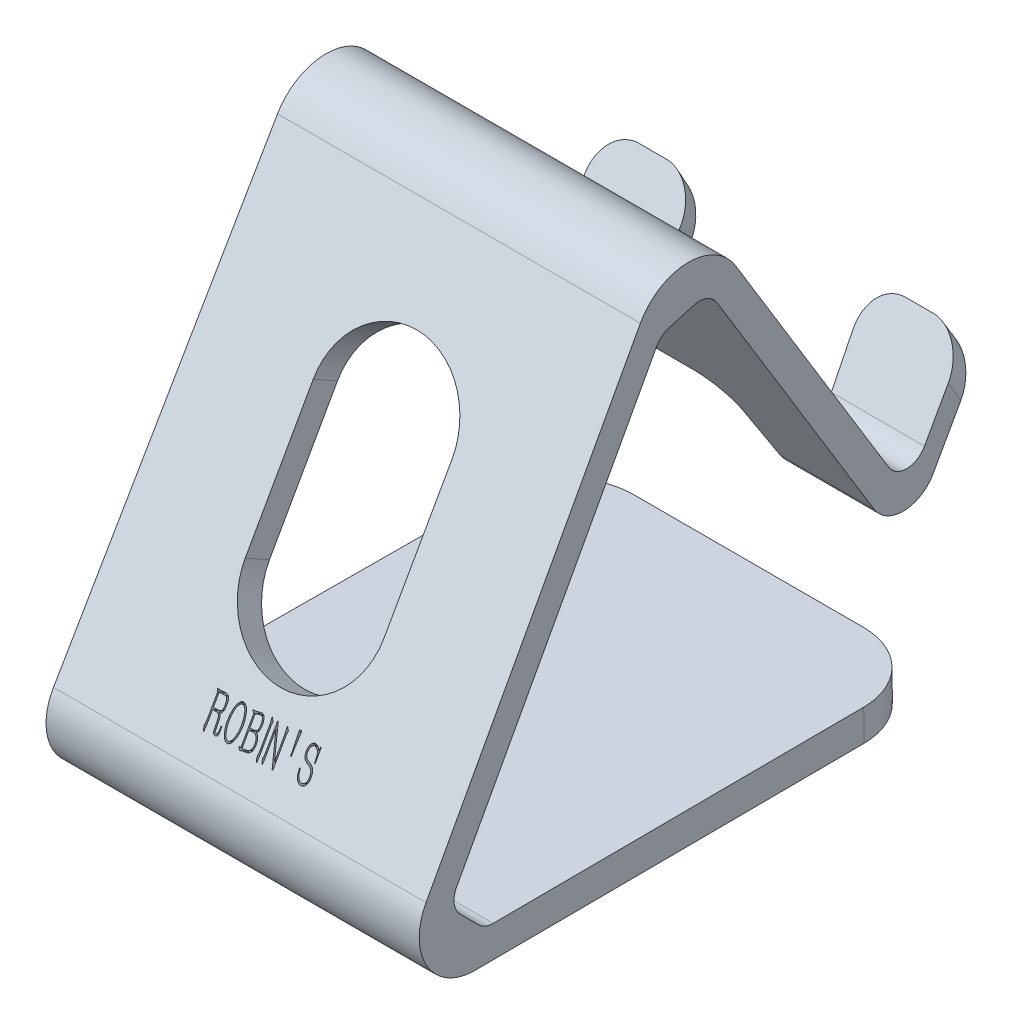
from build123d import *
from OCP.BRepFilletAPI import BRepFilletAPI_MakeChamfer

# Parameters (mm, degrees)
EXTRUDE_1_DEPTH                 = 27
CUT_EXTRUDE_1_DEPTH             = 122.415187402
CUT_EXTRUDE_2_REACH             = 86.433
CUT_EXTRUDE_2_DIRECTION_2_DEPTH = 85.432777042
FILLET_1_R                      = 10
CHAMFER_1_SIZE                  = 8
CHAMFER_1_SIZE2                 = 5.874394869
CHAMFER_1_SIZE2_2               = 5.87441912
FILLET_2_R                      = 8
FILLET_3_R                      = 3
FILLET_4_R                      = 5
FILLET_5_R                      = 5
SKETCH_8_R                      = 7
EXTRUDE_2_DEPTH                 = 1
CUT_EXTRUDE_3_REACH             = 118.382
CUT_EXTRUDE_4_DEPTH             = 1
FILLET_6_R                      = 5
SKETCH_12_R                     = 14.468983122
SKETCH_12_R_2                   = 13.256117975
CUT_EXTRUDE_7_DEPTH             = 1
CUT_EXTRUDE_8_DEPTH             = 1
FILLET_7_R                      = 3


with BuildPart() as part:
    # 草图1 → 凸台-拉伸1 (new, symmetric)
    with BuildSketch(Plane(origin=(0, 0, 0), x_dir=(0, 0, -1), z_dir=(1, 0, 0))):
        Polygon((0, 0), (80, 0), (80, 4.5), (7.120639938, 4.5), (45.133157634, 72.077809239), (76.133157634, 21.058971323), (87.250488433, 40.31475311), (85.433025117, 43.305877831), (76.596172431, 28), (45, 80), align=None)
    extrude(amount=EXTRUDE_1_DEPTH, both=True)

    # 草图4 → 切除-拉伸1 (cut, through all)
    with BuildSketch(Plane(origin=(0, 0, 0), x_dir=(1, 0, 0), z_dir=(0, 0.49026123963255896, 0.8715755371245493))):
        Polygon((-27, 0), (-26, 91.787798753), (-27, 91.787798753), align=None)
        Polygon((26, 91.787798753), (27, 91.787798753), (27, 0), align=None)
    extrude(amount=-CUT_EXTRUDE_1_DEPTH, mode=Mode.SUBTRACT)

    # 草图7 → 切除-拉伸2 (cut, up to next)
    with BuildSketch(Plane(origin=(0, 41.54167411, -68.367998004), x_dir=(-1, 0, 0), z_dir=(0, 0.5192752331681213, -0.8546070630518996)), mode=Mode.PRIVATE) as cut_extrude_2_sk1:
        Polygon((-11.5, 0), (11.5, 0), (14, -25), (-14, -25), align=None)
    cut_extrude_2_tool1 = extrude(cut_extrude_2_sk1.sketch, amount=-CUT_EXTRUDE_2_REACH, mode=Mode.PRIVATE) & part.part
    add(cut_extrude_2_tool1.solids().sort_by_distance((0, 30.509982, -75.071061))[0], mode=Mode.SUBTRACT)

    # 草图7 → 切除-拉伸2 direction 2 (cut)
    with BuildSketch(Plane(origin=(0, 41.54167411, -68.367998004), x_dir=(-1, 0, 0), z_dir=(0, 0.5192752331681213, -0.8546070630518996))):
        Polygon((-11.5, 0), (11.5, 0), (14, -25), (-14, -25), align=None)
    extrude(amount=CUT_EXTRUDE_2_DIRECTION_2_DEPTH, mode=Mode.SUBTRACT)

    # 圆角1
    fillet_1_edges = [part.edges().sort_by_distance(p)[0] for p in [
        (-26.551335312, 2.25, -80),
        (26.551335312, 2.25, -80),
    ]]
    fillet(fillet_1_edges, radius=FILLET_1_R)

    # 倒角1: one chamfer whose edges measure the first distance from different faces: ONE call of the kernel's chamfer builder (chamfer() names one face for all edges)
    chamfer_1_edges_1 = [part.edges().sort_by_distance(p)[0] for p in [
        (0, 72.077809239, -45.133157634),
    ]]
    chamfer_1_side_1 = [part.faces().sort_by_distance(p)[0] for p in [
        (0, 38.109372434, -26.025911932),
    ]]
    chamfer_1_edges_2 = [part.edges().sort_by_distance(p)[0] for p in [
        (0, 4.5, -7.120639938),
    ]]
    chamfer_1_side_2 = [part.faces().sort_by_distance(p)[0] for p in [
        (0, 4.5, -43.094391941),
    ]]
    chamfer_1 = BRepFilletAPI_MakeChamfer(part.part.solid().wrapped)
    for e in chamfer_1_edges_1:
        chamfer_1.Add(CHAMFER_1_SIZE, CHAMFER_1_SIZE2, e.wrapped, chamfer_1_side_1[0].wrapped)  # the first distance lies on this face
    for e in chamfer_1_edges_2:
        chamfer_1.Add(CHAMFER_1_SIZE, CHAMFER_1_SIZE2_2, e.wrapped, chamfer_1_side_2[0].wrapped)  # the first distance lies on this face
    add(Compound.cast(chamfer_1.Shape()), mode=Mode.REPLACE)

    # 圆角2
    fillet_2_edges = [part.edges().sort_by_distance(p)[0] for p in [
        (0, 0, 0),
        (0, 80, -45),
    ]]
    fillet(fillet_2_edges, radius=FILLET_2_R)

    # 圆角3
    fillet_3_edges = [part.edges().sort_by_distance(p)[0] for p in [
        (19.70477768, 28, -76.596172431),
        (-19.70477768, 28, -76.596172431),
    ]]
    fillet(fillet_3_edges, radius=FILLET_3_R)

    # 圆角4
    fillet_4_edges = [part.edges().sort_by_distance(p)[0] for p in [
        (-26.141815514, 41.810315471, -86.341756775),
        (26.141815514, 41.810315471, -86.341756775),
        (-12.410374497, 41.810315471, -86.341756775),
        (12.410374497, 41.810315471, -86.341756775),
    ]]
    fillet(fillet_4_edges, radius=FILLET_4_R)

    # 圆角5
    fillet_5_edges = [part.edges().sort_by_distance(p)[0] for p in [
        (20.023539658, 21.058971323, -76.133157634),
        (-20.023539658, 21.058971323, -76.133157634),
    ]]
    fillet(fillet_5_edges, radius=FILLET_5_R)

    # 草图8 → 凸台-拉伸2 (add)
    with BuildSketch(Plane.XZ):
        with Locations(Location((-16.625519305, -70, 0), (0, 0, 90))):
            Circle(SKETCH_8_R)
        with Locations(Location((16.625519305, -70, 0), (0, 0, 90))):
            Circle(SKETCH_8_R)
        with Locations(Location((0, -25, 0), (0, 0, 90))):
            Circle(SKETCH_8_R)
    extrude(amount=EXTRUDE_2_DEPTH)

    # 草图9 → 切除-拉伸3 (cut, up to next)
    with BuildSketch(Plane(origin=(0, 0, 0), x_dir=(1, 0, 0), z_dir=(0, 0.49026123963255896, 0.8715755371245493)), mode=Mode.PRIVATE) as cut_extrude_3_sk1:
        with BuildLine():
            Line((-10, 35.678779875), (-10, 55.678779875))
            ThreePointArc((-10, 55.678779875), (0, 65.678779875), (10, 55.678779875))
            Line((10, 55.678779875), (10, 35.678779875))
            ThreePointArc((10, 35.678779875), (0, 25.678779875), (-10, 35.678779875))
        make_face()
    cut_extrude_3_tool1 = extrude(cut_extrude_3_sk1.sketch, amount=-CUT_EXTRUDE_3_REACH, mode=Mode.PRIVATE) & part.part
    add(cut_extrude_3_tool1.solids().sort_by_distance((0, 39.812507, -22.394535))[0], mode=Mode.SUBTRACT)

    # 草图11 → 切除-拉伸4 (cut)
    # profile 1 of 7: a face of its own
    with BuildSketch(Plane(origin=(0, 0, 0), x_dir=(1, 0, 0), z_dir=(0, 0.49026123963255896, 0.8715755371245493))):
        with BuildLine():
            add(Edge.make_bspline(
                [(-6.031871762, 20.114633863), (-6.010537227, 20.083758577), (-5.971845225, 20.027763607), (-5.916642006, 19.947027309), (-5.872950531, 19.860818106), (-5.845418093, 19.755333719), (-5.823792472, 19.627997883), (-5.807931117, 19.479922318), (-5.795369729, 19.316135297), (-5.794651528, 19.202309376), (-5.794283865, 19.14403936)],
                knots=[0, 0, 0, 0, 0.881232765, 1.598190978, 2.295533752, 3.137383339, 4.144986829, 5.328248715, 6.632271209, 8, 8, 8, 8], degree=3))
            Line((-5.794283865, 19.14403936), (-5.772975533, 18.474957749))
            add(Edge.make_bspline(
                [(-5.772975533, 18.474957749), (-5.772278621, 18.437702367), (-5.770930834, 18.365652654), (-5.768830268, 18.264066379), (-5.757508267, 18.18036003), (-5.743648254, 18.119503027), (-5.712399467, 18.088081891), (-5.676597232, 18.073727664), (-5.628388459, 18.066521139), (-5.591883792, 18.065396762), (-5.5716118, 18.064772367)],
                knots=[0, 0, 0, 0, 1.650852431, 3.192651296, 4.477622576, 5.427192863, 5.849578153, 6.384274066, 7.102745334, 8, 8, 8, 8], degree=3))
            add(Edge.make_bspline(
                [(-5.5716118, 18.064772367), (-5.551267524, 18.063800581), (-5.513205481, 18.061982469), (-5.45777072, 18.080135669), (-5.412589655, 18.120973015), (-5.381351604, 18.183633875), (-5.357778078, 18.261194957), (-5.344605389, 18.355071783), (-5.331649485, 18.465569962), (-5.324236647, 18.545959337), (-5.320173488, 18.59002274)],
                knots=[0, 0, 0, 0, 0.741895998, 1.388010978, 2.079699508, 2.912679041, 3.92113713, 5.042206699, 6.378760387, 8, 8, 8, 8], degree=3))
            Line((-5.320173488, 18.59002274), (-5.283949324, 19.000208122))
            Line((-5.283949324, 19.000208122), (-5.190192665, 19.000208122))
            Line((-5.190192665, 19.000208122), (-5.190192665, 18.496266081))
            add(Edge.make_bspline(
                [(-5.190192665, 18.496266081), (-5.190603599, 18.448669403), (-5.191361368, 18.360900429), (-5.196581699, 18.240800056), (-5.204058756, 18.143179252), (-5.216702115, 18.066112727), (-5.23400506, 18.003426085), (-5.258587312, 17.951554529), (-5.288569958, 17.905989533), (-5.326369414, 17.87052418), (-5.367040053, 17.840991234), (-5.411592808, 17.819749915), (-5.458469054, 17.804359376), (-5.521607216, 17.795951174), (-5.59331755, 17.793974146), (-5.648331656, 17.797049111), (-5.672826375, 17.798418222)],
                knots=[0, 0, 0, 0, 1.955595562, 3.606146949, 4.93917426, 5.975540879, 6.81139212, 7.601269519, 8.32576276, 9.0378047, 9.718034635, 10.383709129, 11.057491241, 11.736467872, 12.992175141, 14, 14, 14, 14], degree=3))
            add(Edge.make_bspline(
                [(-5.672826375, 17.798418222), (-5.690001811, 17.79986472), (-5.722787711, 17.802625916), (-5.768147962, 17.817431721), (-5.808501618, 17.836358413), (-5.843615393, 17.862510812), (-5.873066011, 17.896819962), (-5.897361131, 17.939391411), (-5.918506828, 17.989903133), (-5.93687243, 18.050147366), (-5.952104568, 18.123506811), (-5.961307314, 18.213085618), (-5.97034802, 18.319968917), (-5.972942089, 18.397158775), (-5.974339266, 18.438733586)],
                knots=[0, 0, 0, 0, 0.785514098, 1.499454538, 2.167605402, 2.81714562, 3.484704239, 4.219933844, 5.049370252, 5.984178009, 7.095655963, 8.469322192, 10.098360771, 12, 12, 12, 12], degree=3))
            Line((-5.974339266, 18.438733586), (-5.981797182, 18.783928557))
            Line((-5.981797182, 18.783928557), (-5.989255099, 19.136581444))
            add(Edge.make_bspline(
                [(-5.989255099, 19.136581444), (-5.991891855, 19.182764894), (-5.997494267, 19.28089255), (-6.010186399, 19.429373872), (-6.023964622, 19.573287756), (-6.049092074, 19.69977443), (-6.086251021, 19.806622926), (-6.135316087, 19.897635117), (-6.195844731, 19.972957307), (-6.271686157, 20.025098442), (-6.360310373, 20.054209998), (-6.461305739, 20.070121018), (-6.576629827, 20.076063255), (-6.657989311, 20.072718219), (-6.700953373, 20.070951783)],
                knots=[0, 0, 0, 0, 1.186982176, 2.522024164, 3.82431485, 4.894934829, 5.823070192, 6.716229133, 7.537699214, 8.278355097, 9.042196562, 9.911176558, 10.896940655, 12, 12, 12, 12], degree=3))
            Line((-6.700953373, 20.070951783), (-7.05360626, 20.042185535))
            Line((-7.05360626, 20.042185535), (-7.05360626, 18.344976927))
            add(Edge.make_bspline(
                [(-7.05360626, 18.344976927), (-7.056728811, 18.289214885), (-7.06241774, 18.187622845), (-7.071063976, 18.050932221), (-7.077698545, 17.944736311), (-7.082766759, 17.847766737), (-7.089428028, 17.754893428), (-7.099314951, 17.676795428), (-7.110205942, 17.626003946), (-7.115466454, 17.604684457), (-7.122523222, 17.587632153), (-7.129783868, 17.589848887), (-7.132447087, 17.59066199)],
                knots=[0, 0, 0, 0, 2.178702561, 3.969346042, 5.343442504, 6.32866056, 7.759955515, 8.962971945, 9.43033784, 9.732921223, 9.902035012, 10, 10, 10, 10], degree=3))
            add(Edge.make_bspline(
                [(-7.132447087, 17.59066199), (-7.135674331, 17.591628094), (-7.143627526, 17.594008953), (-7.159359365, 17.602931104), (-7.17644025, 17.630267191), (-7.195295087, 17.670397122), (-7.213349641, 17.71699733), (-7.217117732, 17.749301605), (-7.218745829, 17.763259475)],
                knots=[0, 0, 0, 0, 0.301236197, 0.742364128, 1.580669581, 3.100179862, 4.747060191, 6, 6, 6, 6], degree=3))
            Line((-7.218745829, 17.763259475), (-7.305044572, 18.022155704))
            add(Edge.make_bspline(
                [(-7.305044572, 18.022155704), (-7.313162875, 18.04559767), (-7.327415368, 18.086752387), (-7.34634664, 18.139670095), (-7.356388872, 18.175770699), (-7.361453718, 18.204859612), (-7.349152986, 18.23426363), (-7.331461922, 18.273611252), (-7.311236585, 18.327481207), (-7.293878373, 18.392165811), (-7.278714649, 18.45788117), (-7.268826129, 18.513410845), (-7.265183716, 18.565162292), (-7.260375678, 18.623325695), (-7.257965611, 18.702246646), (-7.255124802, 18.793875158), (-7.25165217, 18.882997915), (-7.25061108, 18.954426869), (-7.247273875, 19.000185827), (-7.247456235, 19.022225375), (-7.247512077, 19.02897437)],
                knots=[0, 0, 0, 0, 1.301962309, 2.285725083, 2.940890519, 3.278257869, 3.802826989, 4.553745501, 5.567560366, 6.806006901, 8.066807115, 9.104973239, 9.759343731, 10.786589445, 12.166193442, 13.899498157, 15.595566675, 16.84419832, 17.646068083, 18, 18, 18, 18], degree=3))
            Line((-7.247512077, 19.02897437), (-7.247512077, 21.840608719))
            add(Edge.make_bspline(
                [(-7.247512077, 21.840608719), (-7.248002868, 21.862332542), (-7.24894152, 21.903879968), (-7.259405936, 21.962939656), (-7.272580566, 22.016964077), (-7.289481036, 22.048267416), (-7.297586656, 22.063280784)],
                knots=[0, 0, 0, 0, 1.127954724, 2.157245254, 3.116197974, 4, 4, 4, 4], degree=3))
            Line((-7.297586656, 22.063280784), (-7.370034983, 22.170887858))
            add(Edge.make_bspline(
                [(-7.370034983, 22.170887858), (-7.377315278, 22.183891136), (-7.390414249, 22.207287108), (-7.405621473, 22.240342189), (-7.410565128, 22.266920777), (-7.412303972, 22.289439483), (-7.395949446, 22.305758734), (-7.368341803, 22.309278818), (-7.330057949, 22.309250654), (-7.300756679, 22.303948551), (-7.283736241, 22.30086868)],
                knots=[0, 0, 0, 0, 1.380566717, 2.483966017, 3.320820912, 3.912566683, 4.446905125, 5.258929739, 6.407774973, 8, 8, 8, 8], degree=3))
            Line((-7.283736241, 22.30086868), (-7.132447087, 22.285952848))
            Line((-7.132447087, 22.285952848), (-6.981157933, 22.264644517))
            Line((-6.981157933, 22.264644517), (-6.700953373, 22.285952848))
            add(Edge.make_bspline(
                [(-6.700953373, 22.285952848), (-6.645561351, 22.289680281), (-6.544037127, 22.296512036), (-6.405112659, 22.303426196), (-6.293952188, 22.30981764), (-6.205998681, 22.315241511), (-6.131873671, 22.315840309), (-6.063061963, 22.303221886), (-5.995613642, 22.282033227), (-5.930625001, 22.250763314), (-5.869427272, 22.211798404), (-5.813589577, 22.165646622), (-5.763829343, 22.112924328), (-5.720698218, 22.051912463), (-5.682422218, 21.981497982), (-5.652469921, 21.897877965), (-5.625513374, 21.802270875), (-5.606579045, 21.693623797), (-5.590646395, 21.574558181), (-5.578913932, 21.445895873), (-5.572806156, 21.307961904), (-5.572018639, 21.213084064), (-5.5716118, 21.164069192)],
                knots=[0, 0, 0, 0, 1.680330416, 3.079761997, 4.210278293, 5.049824392, 5.748610684, 6.446652486, 7.157163236, 7.883197757, 8.622714282, 9.348032282, 10.070477093, 10.810227951, 11.603784503, 12.488235885, 13.492302087, 14.607589106, 15.822258459, 17.128285687, 18.516442711, 20, 20, 20, 20], degree=3))
            add(Edge.make_bspline(
                [(-5.5716118, 21.164069192), (-5.572002154, 21.117185481), (-5.572733013, 21.029405252), (-5.578429354, 20.907387326), (-5.589798144, 20.804149948), (-5.610466108, 20.694660676), (-5.645472471, 20.577064217), (-5.694654992, 20.451684288), (-5.74924694, 20.342764804), (-5.799896214, 20.265999501), (-5.841468639, 20.217339992), (-5.86877479, 20.188451597), (-5.896560071, 20.168856087), (-5.915601033, 20.160879761), (-5.924264687, 20.157250526)],
                knots=[0, 0, 0, 0, 1.521433389, 2.848575118, 3.962184411, 4.888901171, 6.460870269, 7.93539991, 9.254863418, 10.408771879, 10.907539274, 11.331296887, 11.695739513, 12, 12, 12, 12], degree=3))
            Line((-5.924264687, 20.157250526), (-6.031871762, 20.114633863))
        make_face()
        with BuildLine():
            Line((-7.059998759, 20.30853968), (-6.348300485, 20.337305927))
            add(Edge.make_bspline(
                [(-6.348300485, 20.337305927), (-6.319844138, 20.338966057), (-6.265903054, 20.342112954), (-6.189942556, 20.353795324), (-6.123296542, 20.370316305), (-6.049370952, 20.399657559), (-5.972091697, 20.446994602), (-5.910547617, 20.509539238), (-5.873037983, 20.568362794), (-5.850638536, 20.621387656), (-5.828504859, 20.681105307), (-5.812004752, 20.751665005), (-5.796245577, 20.835386992), (-5.786837587, 20.937339963), (-5.7791551, 21.058479168), (-5.776902596, 21.193879317), (-5.776495352, 21.331492574), (-5.78536097, 21.459867059), (-5.798971835, 21.573353774), (-5.815371244, 21.642903261), (-5.823050112, 21.675469149)],
                knots=[0, 0, 0, 0, 0.918061632, 1.740252825, 2.473002692, 3.125389995, 4.297175273, 5.365424526, 5.921000699, 6.535663214, 7.216150394, 7.97108314, 8.866688876, 9.959840128, 11.266871048, 12.777820325, 14.322752802, 15.699036693, 16.922595727, 18, 18, 18, 18], degree=3))
            add(Edge.make_bspline(
                [(-5.823050112, 21.675469149), (-5.831409533, 21.705622534), (-5.847086033, 21.762169462), (-5.882165339, 21.837052784), (-5.919078576, 21.899817618), (-5.966234371, 21.946268226), (-6.019388006, 21.9812458), (-6.080073971, 22.008296964), (-6.150019251, 22.02594392), (-6.199760282, 22.031571173), (-6.225777579, 22.034514536)],
                knots=[0, 0, 0, 0, 1.275305387, 2.391592206, 3.369358846, 4.230813774, 5.067494819, 5.95694154, 6.931367957, 8, 8, 8, 8], degree=3))
            add(Edge.make_bspline(
                [(-6.225777579, 22.034514536), (-6.234301723, 22.034569667), (-6.255261985, 22.034705231), (-6.292183001, 22.03318143), (-6.340839814, 22.03225867), (-6.400873833, 22.031496947), (-6.472235447, 22.028873466), (-6.5550061, 22.027203807), (-6.649094158, 22.023573335), (-6.715867308, 22.021667613), (-6.751027952, 22.02066412)],
                knots=[0, 0, 0, 0, 0.389305479, 0.957274318, 1.687402304, 2.612145096, 3.699440328, 4.948883328, 6.393377747, 8, 8, 8, 8], degree=3))
            Line((-6.751027952, 22.02066412), (-7.05360626, 22.005748288))
            Line((-7.05360626, 22.005748288), (-7.059998759, 20.30853968))
        make_face(mode=Mode.SUBTRACT)
    # profile 2 of 7: a face of its own
    with BuildSketch(Plane(origin=(0, 0, 0), x_dir=(1, 0, 0), z_dir=(0, 0.49026123963255896, 0.8715755371245493))):
        with BuildLine():
            add(Edge.make_bspline(
                [(-4.800250198, 20.150858026), (-4.795870003, 20.219805993), (-4.786844294, 20.361878307), (-4.761303821, 20.579949712), (-4.728298226, 20.809521333), (-4.687069834, 21.045518215), (-4.635494338, 21.279352423), (-4.56508265, 21.498428625), (-4.481139421, 21.70023358), (-4.381964285, 21.879313041), (-4.278022846, 22.033853365), (-4.177622077, 22.16012686), (-4.083115864, 22.257213852), (-3.990000149, 22.322506839), (-3.901335696, 22.362821742), (-3.819995542, 22.390823937), (-3.743817191, 22.409080632), (-3.694435116, 22.408670939), (-3.670908625, 22.408475755)],
                knots=[0, 0, 0, 0, 1.217793816, 2.509352989, 3.869389901, 5.306369188, 6.732518591, 8.086865491, 9.357865112, 10.57959578, 11.689225504, 12.637700741, 13.421327601, 14.069152645, 14.629329011, 15.132240194, 15.586583926, 16, 16, 16, 16], degree=3))
            add(Edge.make_bspline(
                [(-3.670908625, 22.408475755), (-3.648349328, 22.404561252), (-3.600382141, 22.396237956), (-3.527439201, 22.367592875), (-3.448618942, 22.328327542), (-3.365890014, 22.275147798), (-3.282763352, 22.207436991), (-3.204154927, 22.122073803), (-3.133155093, 22.018493499), (-3.045724289, 21.857423252), (-2.950592753, 21.636150541), (-2.875548174, 21.400970444), (-2.826879838, 21.202689894), (-2.793305824, 21.044353759), (-2.766236796, 20.877136394), (-2.735328659, 20.644193648), (-2.707536045, 20.348204656), (-2.711962025, 20.110433621), (-2.714164538, 19.992110956)],
                knots=[0, 0, 0, 0, 0.394985608, 0.839846589, 1.347857167, 1.916750551, 2.536277094, 3.196746505, 3.915575437, 4.701623328, 6.36253532, 8.071356979, 8.963406565, 9.891884595, 10.869033514, 11.891140732, 13.955296867, 16, 16, 16, 16], degree=3))
            add(Edge.make_bspline(
                [(-2.714164538, 19.992110956), (-2.716010288, 19.947703652), (-2.719839054, 19.855586521), (-2.731456004, 19.713371714), (-2.750638265, 19.562593932), (-2.779347484, 19.349183104), (-2.83312964, 19.076110489), (-2.90747314, 18.805586843), (-2.980538197, 18.593955566), (-3.04327583, 18.443166593), (-3.112631844, 18.300061227), (-3.189323004, 18.168079797), (-3.269005838, 18.049298893), (-3.35436616, 17.950832341), (-3.440642807, 17.871725095), (-3.530547544, 17.815932933), (-3.617360781, 17.777970033), (-3.697872615, 17.751562131), (-3.77313087, 17.738611133), (-3.820743764, 17.740150027), (-3.843506111, 17.740885727)],
                knots=[0, 0, 0, 0, 0.881282943, 1.828105941, 2.82824081, 3.894865892, 6.097710261, 8.340987808, 9.452332789, 10.535200188, 11.577677107, 12.603151353, 13.560288859, 14.408919748, 15.182050945, 15.871786862, 16.496001568, 17.057257397, 17.549302039, 18, 18, 18, 18], degree=3))
            add(Edge.make_bspline(
                [(-3.843506111, 17.740885727), (-3.867096935, 17.743688735), (-3.916618986, 17.749572831), (-3.992201229, 17.774669369), (-4.072062033, 17.812511512), (-4.156446021, 17.863370913), (-4.241875196, 17.931791029), (-4.321172085, 18.023440405), (-4.398328503, 18.133904695), (-4.469091229, 18.264651239), (-4.535280141, 18.410037735), (-4.594463956, 18.566931249), (-4.647849488, 18.732603087), (-4.694226294, 18.905037456), (-4.731388887, 19.080249384), (-4.763181859, 19.25202102), (-4.783898725, 19.418930396), (-4.79840589, 19.579555515), (-4.803540761, 19.733540535), (-4.807370708, 19.879860423), (-4.806596588, 20.018103109), (-4.802320993, 20.107540762), (-4.800250198, 20.150858026)],
                knots=[0, 0, 0, 0, 0.510534934, 1.071719088, 1.704710998, 2.411693894, 3.189282936, 4.05053371, 5.011670478, 6.086573801, 7.246791516, 8.449877322, 9.695482973, 10.994127406, 12.29322218, 13.551907867, 14.754774865, 15.913908135, 17.0238299, 18.071869134, 19.066149983, 20, 20, 20, 20], degree=3))
        make_face()
        with BuildLine():
            add(Edge.make_bspline(
                [(-4.591428548, 20.135942194), (-4.593444941, 20.100437649), (-4.5976971, 20.025565839), (-4.599339602, 19.907234461), (-4.598382972, 19.777211135), (-4.591536737, 19.586442004), (-4.566719139, 19.334614809), (-4.522983942, 19.079893191), (-4.473754711, 18.877121195), (-4.431283205, 18.731778024), (-4.384592642, 18.594147466), (-4.332083519, 18.467069387), (-4.276295954, 18.352480678), (-4.214725824, 18.256050377), (-4.153161086, 18.174904437), (-4.084661567, 18.115673563), (-4.018381092, 18.069808466), (-3.954285916, 18.038673412), (-3.894758972, 18.014787619), (-3.855056858, 18.00968359), (-3.836048195, 18.007239872)],
                knots=[0, 0, 0, 0, 0.796536737, 1.679732718, 2.650327695, 3.709147218, 5.954918549, 8.313069364, 9.492003862, 10.627402775, 11.704181224, 12.745734999, 13.706334556, 14.553839847, 15.30675304, 15.97732542, 16.573080319, 17.10674674, 17.572326302, 18, 18, 18, 18], degree=3))
            add(Edge.make_bspline(
                [(-3.836048195, 18.007239872), (-3.816476636, 18.006087977), (-3.775964922, 18.003703637), (-3.71372939, 18.015924773), (-3.64860419, 18.037425397), (-3.58116157, 18.072109802), (-3.511270593, 18.121660721), (-3.444422702, 18.193222684), (-3.377735446, 18.283369198), (-3.312311636, 18.390757107), (-3.249392681, 18.509853132), (-3.193496813, 18.637447689), (-3.141529639, 18.769216117), (-3.084513385, 18.953937195), (-3.021644732, 19.191546326), (-2.97222917, 19.481763276), (-2.937817703, 19.764858127), (-2.919481972, 19.994678758), (-2.916754851, 20.177508812), (-2.920358677, 20.324959059), (-2.928471558, 20.485262703), (-2.93889408, 20.596234513), (-2.944294519, 20.653734651)],
                knots=[0, 0, 0, 0, 0.389303871, 0.805830913, 1.253424913, 1.753499798, 2.311288848, 2.951911425, 3.695005091, 4.54345845, 5.455166886, 6.377091015, 7.318103512, 8.276048787, 10.227707478, 12.21152619, 14.136557685, 15.91040834, 16.802233067, 17.779101204, 18.849239395, 20, 20, 20, 20], degree=3))
            add(Edge.make_bspline(
                [(-2.944294519, 20.653734651), (-2.950238154, 20.706002334), (-2.961790099, 20.807588887), (-2.985900031, 20.95376786), (-3.010634022, 21.090182957), (-3.051052989, 21.257323364), (-3.109513589, 21.45943456), (-3.184680469, 21.653035118), (-3.253202973, 21.798654067), (-3.308439187, 21.893270283), (-3.371336734, 21.970133309), (-3.43703157, 22.031048218), (-3.503737736, 22.076541467), (-3.566430238, 22.111595526), (-3.626893187, 22.134275403), (-3.666851903, 22.139595573), (-3.685824457, 22.14212161)],
                knots=[0, 0, 0, 0, 1.251575308, 2.432539829, 3.524812851, 4.549720602, 6.523204923, 8.527303315, 9.483611249, 10.351763581, 11.126540771, 11.838283349, 12.475927762, 13.043152764, 13.545685196, 14, 14, 14, 14], degree=3))
            add(Edge.make_bspline(
                [(-3.685824457, 22.14212161), (-3.704337653, 22.140776619), (-3.743569699, 22.137926395), (-3.804722082, 22.124222669), (-3.868270833, 22.096673845), (-3.939370684, 22.063433047), (-4.014366377, 22.00741512), (-4.090321832, 21.922918964), (-4.170251537, 21.81080372), (-4.255675778, 21.674625965), (-4.337488439, 21.514863664), (-4.404371789, 21.332645783), (-4.462825495, 21.133622202), (-4.503025386, 20.920454718), (-4.536482829, 20.707115518), (-4.561406345, 20.503387345), (-4.582084418, 20.314910554), (-4.588404011, 20.19387122), (-4.591428548, 20.135942194)],
                knots=[0, 0, 0, 0, 0.37757334, 0.800130614, 1.267198275, 1.784369715, 2.394414205, 3.156344445, 4.08734282, 5.194407036, 6.425938495, 7.73207238, 9.1388751, 10.642807986, 12.142427514, 13.533772035, 14.819671431, 16, 16, 16, 16], degree=3))
        make_face(mode=Mode.SUBTRACT)
    # profile 3 of 7: a face of its own
    with BuildSketch(Plane(origin=(0, 0, 0), x_dir=(1, 0, 0), z_dir=(0, 0.49026123963255896, 0.8715755371245493))):
        with BuildLine():
            add(Edge.make_bspline(
                [(-2.007793347, 21.90559913), (-2.025190842, 21.919082393), (-2.056742444, 21.943535253), (-2.104031883, 21.980313239), (-2.148400052, 22.028634126), (-2.190116405, 22.073560567), (-2.223028451, 22.114693822), (-2.239692277, 22.142219781), (-2.25097203, 22.163586582), (-2.249225442, 22.185538302), (-2.237204332, 22.202325561), (-2.225557358, 22.224313367), (-2.193544179, 22.230210175), (-2.158180278, 22.216911121), (-2.120565776, 22.205731297), (-2.090958167, 22.195997437), (-2.064951811, 22.195195837), (-2.034061145, 22.195063265), (-1.989695879, 22.198141353), (-1.935659054, 22.19921482), (-1.880851554, 22.202950887), (-1.833468952, 22.209123032), (-1.797241481, 22.212417497), (-1.777955399, 22.21927302), (-1.77020545, 22.222027854)],
                knots=[0, 0, 0, 0, 1.64763205, 2.988098512, 4.472525849, 6.542356651, 7.584071831, 8.395257026, 8.967619365, 9.340564694, 9.97047718, 10.50190227, 11.107820098, 12.171334353, 13.314207223, 14.055349962, 14.481319576, 15.251885957, 16.369143228, 17.804974755, 19.296756072, 20.473415709, 21.386554954, 22, 22, 22, 22], degree=3))
            Line((-1.77020545, 22.222027854), (-1.410094647, 22.314719096))
            add(Edge.make_bspline(
                [(-1.410094647, 22.314719096), (-1.399114935, 22.317687263), (-1.374817508, 22.324255634), (-1.333652362, 22.332081402), (-1.285179091, 22.343219842), (-1.230719017, 22.353948419), (-1.176706502, 22.36613978), (-1.127426532, 22.372634235), (-1.086739579, 22.379383249), (-1.062079329, 22.379608677), (-1.05104926, 22.379709507)],
                knots=[0, 0, 0, 0, 0.746644526, 1.652278328, 2.750112717, 4.012480095, 5.297690843, 6.382818677, 7.276664985, 8, 8, 8, 8], degree=3))
            add(Edge.make_bspline(
                [(-1.05104926, 22.379709507), (-1.027509285, 22.377149001), (-0.980474474, 22.372032899), (-0.911390544, 22.352842059), (-0.845793273, 22.32083973), (-0.78308225, 22.279699367), (-0.725898242, 22.228217673), (-0.67374883, 22.168918715), (-0.629036067, 22.100374033), (-0.591825034, 22.022314981), (-0.560196996, 21.935888134), (-0.533191028, 21.839771841), (-0.512829821, 21.733803994), (-0.496308458, 21.621055556), (-0.483932547, 21.508004001), (-0.475578618, 21.400320674), (-0.469862624, 21.301212005), (-0.468782072, 21.237944751), (-0.468266392, 21.207751272)],
                knots=[0, 0, 0, 0, 0.788100513, 1.574689806, 2.373814472, 3.210589555, 4.065404581, 4.929098289, 5.834801075, 6.781980012, 7.803943584, 8.897694274, 10.10426717, 11.396006919, 12.693423483, 13.892139677, 14.994050896, 16, 16, 16, 16], degree=3))
            add(Edge.make_bspline(
                [(-0.468266392, 21.207751272), (-0.471340263, 21.159410952), (-0.477548326, 21.061781705), (-0.49587342, 20.914098165), (-0.523370504, 20.762572074), (-0.556115677, 20.637165911), (-0.586127478, 20.543147713), (-0.608828629, 20.487044411), (-0.629091544, 20.444014425), (-0.647904673, 20.424369834), (-0.65577971, 20.416146754)],
                knots=[0, 0, 0, 0, 1.41233288, 2.852380741, 4.337314802, 5.89979107, 6.630150315, 7.21096505, 7.669715816, 8, 8, 8, 8], degree=3))
            Line((-0.65577971, 20.416146754), (-0.806003447, 20.265923017))
            add(Edge.make_bspline(
                [(-0.806003447, 20.265923017), (-0.77359714, 20.243791594), (-0.714964362, 20.203749179), (-0.648588187, 20.147602361), (-0.601091563, 20.099727032), (-0.566093556, 20.052294093), (-0.526062199, 19.994386886), (-0.469416124, 19.900172483), (-0.401807361, 19.765901441), (-0.35881218, 19.614550887), (-0.332664302, 19.481428541), (-0.322415622, 19.367251473), (-0.315413211, 19.241437105), (-0.316440861, 19.153640304), (-0.316977238, 19.107815197)],
                knots=[0, 0, 0, 0, 1.070182896, 1.936283469, 2.368030692, 2.906882123, 3.541225939, 4.289096852, 5.905680189, 7.625612947, 8.562596306, 9.604952081, 10.749916543, 12, 12, 12, 12], degree=3))
            add(Edge.make_bspline(
                [(-0.316977238, 19.107815197), (-0.318723585, 19.064468503), (-0.322121595, 18.980125278), (-0.333490916, 18.856961884), (-0.352303069, 18.740903703), (-0.373515394, 18.631282062), (-0.402586552, 18.529441353), (-0.437147745, 18.435754801), (-0.47905092, 18.350258062), (-0.528362353, 18.273342999), (-0.583897561, 18.203519048), (-0.64678125, 18.141035194), (-0.715969051, 18.084572415), (-0.792083003, 18.034454738), (-0.873530011, 17.990695317), (-0.9613065, 17.955637186), (-1.053790208, 17.926347002), (-1.118373925, 17.913579673), (-1.151198418, 17.907090713)],
                knots=[0, 0, 0, 0, 1.291181941, 2.512358873, 3.678492505, 4.789671877, 5.833657235, 6.827132701, 7.758433233, 8.661592748, 9.541502867, 10.408556622, 11.295108621, 12.19516981, 13.117306623, 14.041863747, 15.004782726, 16, 16, 16, 16], degree=3))
            Line((-1.151198418, 17.907090713), (-1.568841717, 17.849558218))
            add(Edge.make_bspline(
                [(-1.568841717, 17.849558218), (-1.591176395, 17.845720731), (-1.633271238, 17.838488104), (-1.692584873, 17.832650687), (-1.743031583, 17.823426839), (-1.796952189, 17.819774986), (-1.854044778, 17.809273047), (-1.905554926, 17.779772533), (-1.93268265, 17.74773995), (-1.951190585, 17.737512069), (-1.956653351, 17.734493228)],
                knots=[0, 0, 0, 0, 1.312917143, 2.474494646, 3.452532002, 4.279929402, 5.608244096, 6.780169529, 7.639957153, 8, 8, 8, 8], degree=3))
            add(Edge.make_bspline(
                [(-1.956653351, 17.734493228), (-1.962147908, 17.733883968), (-1.976075412, 17.732339628), (-1.991753298, 17.747284823), (-2.008858784, 17.763524001), (-2.031497454, 17.780784806), (-2.059749679, 17.804830929), (-2.10729791, 17.83948107), (-2.162632352, 17.887486497), (-2.214932781, 17.947693562), (-2.248348188, 17.999910083), (-2.267042078, 18.041741762), (-2.270558156, 18.067663615), (-2.272318248, 18.089087302), (-2.245624059, 18.096184101), (-2.227999345, 18.099004356), (-2.21554958, 18.10099653)],
                knots=[0, 0, 0, 0, 0.408406666, 1.035221836, 1.516918604, 2.252554637, 3.200824533, 4.366195779, 6.758465887, 8.80503204, 10.444321207, 11.5313617, 12.220697094, 12.548554928, 12.974726626, 14, 14, 14, 14], degree=3))
            Line((-2.21554958, 18.10099653), (-2.007793347, 18.10099653))
            Line((-2.007793347, 18.10099653), (-2.007793347, 21.90559913))
        make_face()
        with BuildLine():
            Line((-1.820280029, 20.323455512), (-1.252412993, 20.387380507))
            add(Edge.make_bspline(
                [(-1.252412993, 20.387380507), (-1.2232819, 20.391203167), (-1.168505212, 20.398391111), (-1.092393564, 20.4096359), (-1.028195363, 20.421835674), (-0.973042207, 20.432245671), (-0.924132422, 20.451940007), (-0.881222226, 20.485472653), (-0.841204023, 20.530410974), (-0.792762527, 20.606666293), (-0.739826876, 20.713003243), (-0.695344334, 20.851404822), (-0.666473135, 20.997327976), (-0.660979735, 21.150199275), (-0.662465555, 21.304689578), (-0.662269317, 21.408044754), (-0.662172209, 21.459189584)],
                knots=[0, 0, 0, 0, 0.873777503, 1.643008589, 2.287243073, 2.817622504, 3.309938555, 3.837999608, 4.421262104, 5.092045153, 6.518435707, 7.941185456, 9.403523715, 10.926684676, 12.47918417, 14, 14, 14, 14], degree=3))
            add(Edge.make_bspline(
                [(-0.662172209, 21.459189584), (-0.66455647, 21.491204795), (-0.669101466, 21.552233782), (-0.682737427, 21.638777412), (-0.696664061, 21.716237773), (-0.720448984, 21.804735555), (-0.759794391, 21.902758897), (-0.819812135, 21.984524901), (-0.874429475, 22.036436507), (-0.916321512, 22.067730351), (-0.961611042, 22.087925596), (-1.021099576, 22.102337232), (-1.090681876, 22.108825567), (-1.157646189, 22.105437558), (-1.210531723, 22.095718275), (-1.257897662, 22.087538819), (-1.313419068, 22.075320033), (-1.353610237, 22.067454356), (-1.3749359, 22.063280784)],
                knots=[0, 0, 0, 0, 1.337822755, 2.550224273, 3.650783, 4.616944903, 6.368664393, 8.021145033, 8.796181901, 9.507039394, 10.189576941, 10.84675067, 12.051897664, 13.090030714, 13.630410622, 14.292569305, 15.094027531, 16, 16, 16, 16], degree=3))
            Line((-1.3749359, 22.063280784), (-1.820280029, 21.948215793))
            Line((-1.820280029, 21.948215793), (-1.820280029, 20.323455512))
        make_face(mode=Mode.SUBTRACT)
        with BuildLine():
            add(Edge.make_bspline(
                [(-1.820280029, 18.10099653), (-1.789395086, 18.098705817), (-1.732634779, 18.094495947), (-1.655520731, 18.090984964), (-1.594052091, 18.091065697), (-1.543804877, 18.09259225), (-1.495051094, 18.099945532), (-1.438335653, 18.104948058), (-1.369372371, 18.116088903), (-1.263462756, 18.127933329), (-1.13236795, 18.153460148), (-1.006321955, 18.186035532), (-0.91574124, 18.2265722), (-0.852696509, 18.26887463), (-0.792190335, 18.322806324), (-0.719885214, 18.410449813), (-0.639814749, 18.525327257), (-0.574761199, 18.672664772), (-0.531834976, 18.817899149), (-0.513278788, 18.962728701), (-0.506842468, 19.104586972), (-0.510259892, 19.198021618), (-0.511948472, 19.244188518)],
                knots=[0, 0, 0, 0, 0.898162711, 1.650642252, 2.237699247, 2.68104558, 3.106443072, 3.666024881, 4.33166218, 5.131363942, 6.755447525, 8.202702255, 8.893980373, 9.622392647, 10.39559097, 11.23565845, 12.912443945, 14.438192962, 15.885447693, 17.289548788, 18.660741617, 20, 20, 20, 20], degree=3))
            add(Edge.make_bspline(
                [(-0.511948472, 19.244188518), (-0.517685117, 19.303986843), (-0.528718601, 19.418998973), (-0.560905853, 19.583187394), (-0.610331139, 19.732095621), (-0.686446402, 19.860065591), (-0.779532209, 19.967420643), (-0.887279642, 20.048189979), (-0.997735393, 20.102113616), (-1.092012073, 20.128571015), (-1.173475676, 20.134861685), (-1.250683341, 20.13566908), (-1.346271389, 20.130668222), (-1.415792973, 20.125122005), (-1.453776726, 20.122091779)],
                knots=[0, 0, 0, 0, 1.438130322, 2.76600445, 4.000792246, 5.175154235, 6.308219456, 7.383388526, 8.376306419, 9.238740087, 9.708503365, 10.329505009, 11.087309779, 12, 12, 12, 12], degree=3))
            Line((-1.453776726, 20.122091779), (-1.820280029, 20.078409699))
            Line((-1.820280029, 20.078409699), (-1.820280029, 18.10099653))
        make_face(mode=Mode.SUBTRACT)
    # profile 4 of 7: a face of its own
    with BuildSketch(Plane(origin=(0, 0, 0), x_dir=(1, 0, 0), z_dir=(0, 0.49026123963255896, 0.8715755371245493))):
        with BuildLine():
            Line((0.30309521, 22.473466166), (0.360627706, 22.538456577))
            Line((0.360627706, 22.538456577), (0.677056429, 22.113355363))
            add(Edge.make_bspline(
                [(0.677056429, 22.113355363), (0.670592991, 22.089120863), (0.658657534, 22.044369167), (0.636855377, 21.979912804), (0.618475647, 21.911864622), (0.605174545, 21.845999376), (0.597106772, 21.777906831), (0.593288199, 21.708191502), (0.591552291, 21.62185288), (0.591037945, 21.558629332), (0.590757686, 21.524179995)],
                knots=[0, 0, 0, 0, 1.004175213, 1.854321033, 2.723758726, 3.82552311, 4.541751514, 5.467964897, 6.620341098, 8, 8, 8, 8], degree=3))
            Line((0.590757686, 21.524179995), (0.590757686, 18.373743174))
            Line((0.590757686, 18.373743174), (0.569449355, 17.777109891))
            add(Edge.make_bspline(
                [(0.569449355, 17.777109891), (0.568937063, 17.743952055), (0.568000434, 17.683329332), (0.556236907, 17.613859518), (0.544064767, 17.569467228), (0.536732842, 17.550932263), (0.528615647, 17.536670344), (0.522012515, 17.538708011), (0.519374776, 17.539521994)],
                knots=[0, 0, 0, 0, 2.350389122, 4.297234295, 5.032515409, 5.553050425, 5.821457962, 6, 6, 6, 6], degree=3))
            add(Edge.make_bspline(
                [(0.519374776, 17.539521994), (0.51616027, 17.540497733), (0.508238466, 17.542902338), (0.492354214, 17.551354958), (0.47977617, 17.580439845), (0.472734207, 17.604228558), (0.46823478, 17.619428237)],
                knots=[0, 0, 0, 0, 0.403031229, 0.993227006, 2.078837504, 4, 4, 4, 4], degree=3))
            Line((0.46823478, 17.619428237), (0.433076033, 17.712119479))
            Line((0.433076033, 17.712119479), (0.35316979, 17.971015708))
            add(Edge.make_bspline(
                [(0.35316979, 17.971015708), (0.345115374, 17.995896811), (0.331080596, 18.039252006), (0.311653484, 18.094886865), (0.302006094, 18.132491524), (0.296857407, 18.161782306), (0.3082158, 18.190989137), (0.322931237, 18.230957529), (0.341371188, 18.285105107), (0.35826038, 18.350203672), (0.372468605, 18.418510876), (0.382161781, 18.484026981), (0.388639686, 18.544829798), (0.392524763, 18.599571765), (0.395526926, 18.660662777), (0.395665424, 18.739541972), (0.397307051, 18.851398816), (0.397016071, 18.936991806), (0.396851869, 18.98529229)],
                knots=[0, 0, 0, 0, 1.214579163, 2.116397919, 2.728090024, 3.026630229, 3.470478885, 4.138035078, 5.024200554, 6.115768324, 7.260198826, 8.260311231, 9.188705593, 10.09772701, 10.807310684, 12.027247325, 13.758158969, 16, 16, 16, 16], degree=3))
            Line((0.396851869, 18.98529229), (0.396851869, 21.624329153))
            add(Edge.make_bspline(
                [(0.396851869, 21.624329153), (0.39669578, 21.67761639), (0.396396899, 21.779651209), (0.387206711, 21.92603288), (0.374942554, 22.058608025), (0.358713885, 22.174933093), (0.343752661, 22.270653648), (0.335386108, 22.327144757), (0.331861458, 22.35094326)],
                knots=[0, 0, 0, 0, 1.312774966, 2.513711841, 3.612622797, 4.592819118, 5.407184629, 6, 6, 6, 6], degree=3))
            Line((0.331861458, 22.35094326), (0.30309521, 22.473466166))
        make_face()
    # profile 5 of 7: a face of its own
    with BuildSketch(Plane(origin=(0, 0, 0), x_dir=(1, 0, 0), z_dir=(0, 0.49026123963255896, 0.8715755371245493))):
        with BuildLine():
            Line((2.509572943, 22.429784086), (2.574563355, 22.494774498))
            Line((2.574563355, 22.494774498), (2.883534162, 22.113355363))
            add(Edge.make_bspline(
                [(2.883534162, 22.113355363), (2.876801878, 22.090149783), (2.86377669, 22.045253132), (2.842123338, 21.990404766), (2.829268385, 21.942845222), (2.820782235, 21.899425287), (2.813639108, 21.847476491), (2.805750565, 21.771862512), (2.800382539, 21.684770827), (2.798182518, 21.617940545), (2.797235419, 21.589170406)],
                knots=[0, 0, 0, 0, 1.084494799, 2.098210167, 2.643672211, 3.294173657, 4.083496456, 4.997481927, 6.707429351, 8, 8, 8, 8], degree=3))
            Line((2.797235419, 21.589170406), (2.797235419, 17.698269064))
            Line((2.797235419, 17.698269064), (2.689628345, 17.698269064))
            Line((2.689628345, 17.698269064), (1.337614708, 21.552946243))
            Line((1.337614708, 21.552946243), (1.337614708, 18.281051932))
            add(Edge.make_bspline(
                [(1.337614708, 18.281051932), (1.337281754, 18.254062388), (1.336571967, 18.196526429), (1.334952929, 18.104478544), (1.328821404, 18.001942502), (1.322940028, 17.894829255), (1.317146784, 17.797982675), (1.307759656, 17.721481355), (1.30230734, 17.677644179), (1.287838756, 17.645435279), (1.258220221, 17.657805073), (1.234901568, 17.683650224), (1.20904648, 17.733367709), (1.194814844, 17.774113197), (1.186325554, 17.798418222)],
                knots=[0, 0, 0, 0, 1.182286761, 2.52038347, 4.031227312, 5.682702803, 7.210982332, 8.306924227, 8.990285397, 9.270708198, 9.606495757, 10.101576878, 10.867574663, 12, 12, 12, 12], degree=3))
            Line((1.186325554, 17.798418222), (1.071260563, 18.122304862))
            add(Edge.make_bspline(
                [(1.071260563, 18.122304862), (1.063735866, 18.142961779), (1.051076462, 18.177714571), (1.042530121, 18.230263242), (1.055812387, 18.281204536), (1.069492677, 18.33027729), (1.083006366, 18.382455091), (1.09470653, 18.434603883), (1.106263777, 18.497536842), (1.117618653, 18.571108599), (1.130488775, 18.655030922), (1.136459281, 18.749430109), (1.142820384, 18.853452544), (1.142704316, 18.925970688), (1.142643474, 18.963983959)],
                knots=[0, 0, 0, 0, 0.927779361, 1.560877733, 2.200839638, 3.115853294, 3.718492711, 4.470182357, 5.368516448, 6.414355644, 7.608241643, 8.944514625, 10.398345751, 12, 12, 12, 12], degree=3))
            Line((1.142643474, 18.963983959), (1.142643474, 22.444699918))
            Line((1.142643474, 22.444699918), (1.251315965, 22.444699918))
            Line((1.251315965, 22.444699918), (2.603329602, 18.575106908))
            Line((2.603329602, 18.575106908), (2.603329602, 21.58171249))
            add(Edge.make_bspline(
                [(2.603329602, 21.58171249), (2.602690011, 21.640677886), (2.601429429, 21.756893819), (2.593795981, 21.899274699), (2.586658613, 22.005420582), (2.581428324, 22.073262481), (2.576279346, 22.129764763), (2.569112418, 22.189522647), (2.55934898, 22.2555592), (2.545256107, 22.305247457), (2.538339191, 22.329634928)],
                knots=[0, 0, 0, 0, 1.880234277, 3.705786779, 4.545737466, 5.272737238, 5.875620033, 6.354622927, 7.192433219, 8, 8, 8, 8], degree=3))
            Line((2.538339191, 22.329634928), (2.509572943, 22.429784086))
        make_face()
    # profile 6 of 7: a face of its own
    with BuildSketch(Plane(origin=(0, 0, 0), x_dir=(1, 0, 0), z_dir=(0, 0.49026123963255896, 0.8715755371245493))):
        with BuildLine():
            Line((4.273902796, 19.992110956), (4.252594465, 20.128484278))
            Line((4.252594465, 20.128484278), (4.245136549, 20.452370918))
            Line((4.245136549, 20.452370918), (4.209977802, 21.128910445))
            Line((4.209977802, 21.128910445), (4.187604053, 21.617936654))
            Line((4.187604053, 21.617936654), (4.166295722, 22.092047031))
            Line((4.166295722, 22.092047031), (4.152445306, 22.516082829))
            add(Edge.make_bspline(
                [(4.152445306, 22.516082829), (4.151028333, 22.535253838), (4.148406166, 22.570730562), (4.149771436, 22.61976921), (4.148160572, 22.660726313), (4.151114688, 22.685141104), (4.152445306, 22.696138231)],
                knots=[0, 0, 0, 0, 1.278352038, 2.365641966, 3.263837993, 4, 4, 4, 4], degree=3))
            add(Edge.make_bspline(
                [(4.152445306, 22.696138231), (4.155093254, 22.717753827), (4.159915555, 22.757118987), (4.183775068, 22.8070642), (4.215590543, 22.840522643), (4.251955187, 22.860241964), (4.291608876, 22.8663504), (4.317968852, 22.86299299), (4.331435291, 22.8612778)],
                knots=[0, 0, 0, 0, 1.388123159, 2.527975238, 3.477480882, 4.302056574, 5.132576923, 6, 6, 6, 6], degree=3))
            add(Edge.make_bspline(
                [(4.331435291, 22.8612778), (4.345278852, 22.855929597), (4.372453611, 22.845431132), (4.401527552, 22.810971934), (4.423723902, 22.770978884), (4.438126561, 22.731682667), (4.446261837, 22.693516199), (4.451873517, 22.656201557), (4.452992608, 22.610549267), (4.453620668, 22.577516975), (4.453958198, 22.559764909)],
                knots=[0, 0, 0, 0, 1.009092479, 1.980837482, 3.024215728, 4.172429535, 4.850747326, 5.717823987, 6.773523204, 8, 8, 8, 8], degree=3))
            add(Edge.make_bspline(
                [(4.453958198, 22.559764909), (4.452905431, 22.549110087), (4.45037947, 22.523545383), (4.445507451, 22.478182108), (4.443474366, 22.419096425), (4.436510782, 22.319429381), (4.432994212, 22.177601652), (4.42788032, 22.060074387), (4.42519195, 21.998290372)],
                knots=[0, 0, 0, 0, 0.342743849, 0.822364341, 1.459890564, 2.234257353, 4.020351281, 6, 6, 6, 6], degree=3))
            Line((4.42519195, 21.998290372), (4.411341535, 21.545488327))
            Line((4.411341535, 21.545488327), (4.382575287, 20.891322548))
            Line((4.382575287, 20.891322548), (4.375117371, 20.30853968))
            Line((4.375117371, 20.30853968), (4.360201539, 20.042185535))
            add(Edge.make_bspline(
                [(4.360201539, 20.042185535), (4.359787782, 20.020061695), (4.359096073, 19.983075649), (4.343855797, 19.937642717), (4.32260706, 19.914580353), (4.299957096, 19.905755274), (4.282680037, 19.917447898), (4.271546573, 19.935768123), (4.269776056, 19.962475152), (4.272430131, 19.981535143), (4.273902796, 19.992110956)],
                knots=[0, 0, 0, 0, 2.083211322, 3.482657118, 4.382574336, 5.008246272, 5.548279692, 6.180195123, 6.990245252, 8, 8, 8, 8], degree=3))
        make_face()
    # profile 7 of 7: a face of its own
    with BuildSketch(Plane(origin=(0, 0, 0), x_dir=(1, 0, 0), z_dir=(0, 0.49026123963255896, 0.8715755371245493))):
        with BuildLine():
            Line((7.354022123, 21.919449546), (7.42647045, 22.358401176))
            Line((7.42647045, 22.358401176), (7.497853361, 22.35094326))
            Line((7.497853361, 22.35094326), (7.497853361, 20.553585493))
            Line((7.497853361, 20.553585493), (7.411554618, 20.546127577))
            Line((7.411554618, 20.546127577), (7.361480039, 21.30790043))
            add(Edge.make_bspline(
                [(7.361480039, 21.30790043), (7.354887012, 21.350260706), (7.342699595, 21.428565005), (7.318809669, 21.534606619), (7.296651715, 21.621384184), (7.262316881, 21.70932548), (7.211365888, 21.803214245), (7.136315313, 21.903848232), (7.04626809, 21.994498902), (6.93948264, 22.065807992), (6.823742557, 22.120308425), (6.740530254, 22.130666243), (6.699856344, 22.135729111)],
                knots=[0, 0, 0, 0, 1.116474761, 2.063838624, 2.831507158, 3.446633667, 4.518832044, 5.603216916, 6.708904972, 7.82779241, 8.938231816, 10, 10, 10, 10], degree=3))
            add(Edge.make_bspline(
                [(6.699856344, 22.135729111), (6.675623094, 22.134690382), (6.625869393, 22.13255775), (6.563414892, 22.117869221), (6.510188571, 22.098388599), (6.466170179, 22.073326195), (6.417753674, 22.039759751), (6.367176241, 21.998090131), (6.316319922, 21.950475944), (6.271215172, 21.895141041), (6.231619209, 21.834546928), (6.189159728, 21.747203932), (6.146879443, 21.635880018), (6.118929247, 21.520578049), (6.106712179, 21.424192126), (6.099207863, 21.342815659), (6.094388954, 21.251481115), (6.090161209, 21.152722727), (6.09379462, 21.050977504), (6.108455271, 20.951479832), (6.134850086, 20.856814493), (6.161422528, 20.797986232), (6.174605971, 20.768799641)],
                knots=[0, 0, 0, 0, 0.864038106, 1.773971445, 2.275285977, 2.88209936, 3.574564674, 4.376127188, 5.218616224, 6.055847121, 6.916999662, 7.795414815, 9.515900782, 11.157236165, 12.013901558, 12.981067707, 14.072720019, 15.277182195, 16.507433409, 17.699229733, 18.858513907, 20, 20, 20, 20], degree=3))
            add(Edge.make_bspline(
                [(6.174605971, 20.768799641), (6.189532348, 20.741734457), (6.218641065, 20.688953209), (6.273081238, 20.618682858), (6.337016017, 20.561730455), (6.426819713, 20.503705702), (6.5345412, 20.451846791), (6.619450507, 20.417557087), (6.657239681, 20.402296339)],
                knots=[0, 0, 0, 0, 0.892298636, 1.740118821, 2.553971753, 3.353728668, 4.822268012, 6, 6, 6, 6], degree=3))
            Line((6.657239681, 20.402296339), (6.908677993, 20.301081764))
            add(Edge.make_bspline(
                [(6.908677993, 20.301081764), (6.939699151, 20.286775345), (6.999428414, 20.259229245), (7.083611305, 20.215407281), (7.159827496, 20.17207317), (7.247521508, 20.1133796), (7.344149841, 20.03629228), (7.439629287, 19.929977891), (7.517215365, 19.809493553), (7.565882171, 19.66901052), (7.604212734, 19.516609939), (7.630093928, 19.351048487), (7.647181575, 19.170297542), (7.65404978, 18.97691673), (7.651008018, 18.777081427), (7.625463124, 18.646628564), (7.612918351, 18.582564824)],
                knots=[0, 0, 0, 0, 0.703245545, 1.354054533, 1.953549274, 2.507188807, 3.525842386, 4.488918984, 5.43838142, 6.454223102, 7.53246407, 8.673253088, 9.899948524, 11.268249991, 12.658472344, 14, 14, 14, 14], degree=3))
            add(Edge.make_bspline(
                [(7.612918351, 18.582564824), (7.597233471, 18.518317127), (7.566852808, 18.393873237), (7.501123459, 18.250896606), (7.443507458, 18.149792632), (7.400824202, 18.084270054), (7.358143625, 18.027962272), (7.30236311, 17.961881451), (7.216333871, 17.892223004), (7.115963822, 17.836753467), (7.023573607, 17.802266953), (6.9468864, 17.782550794), (6.864548583, 17.772557316), (6.80784098, 17.770638245), (6.778697171, 17.769651975)],
                knots=[0, 0, 0, 0, 1.868422262, 3.619020558, 4.429541533, 5.162879566, 5.830420081, 6.429075538, 7.606854402, 8.938752151, 9.657684361, 10.394048182, 11.174651193, 12, 12, 12, 12], degree=3))
            add(Edge.make_bspline(
                [(6.778697171, 17.769651975), (6.745970096, 17.769860167), (6.681913099, 17.770267662), (6.588193434, 17.785426012), (6.499753383, 17.813169694), (6.417396251, 17.854420939), (6.340371226, 17.905943827), (6.26883498, 17.967061609), (6.202675004, 18.037129339), (6.140200605, 18.114791621), (6.085478022, 18.202486056), (6.036030688, 18.297862202), (5.993736879, 18.401410568), (5.946318974, 18.54755201), (5.904651353, 18.733203417), (5.892733254, 18.883508508), (5.886943495, 18.956526042)],
                knots=[0, 0, 0, 0, 0.833862414, 1.63212638, 2.411403016, 3.189256699, 3.973153178, 4.770028097, 5.583768076, 6.428386665, 7.307987397, 8.215552436, 9.166047206, 10.157242313, 12.13320567, 14, 14, 14, 14], degree=3))
            Line((5.886943495, 18.956526042), (5.858177248, 19.337945177))
            Line((5.858177248, 19.337945177), (5.959391822, 19.337945177))
            add(Edge.make_bspline(
                [(5.959391822, 19.337945177), (5.965213999, 19.292812043), (5.976415043, 19.20598228), (5.996096125, 19.080729094), (6.015066205, 18.965269875), (6.039315367, 18.827285655), (6.077250746, 18.671417284), (6.137013979, 18.502026005), (6.215055677, 18.353371426), (6.298434348, 18.248946029), (6.370137302, 18.17629579), (6.427299924, 18.134585807), (6.482983454, 18.098554246), (6.558450713, 18.067736338), (6.652482951, 18.043112548), (6.72811256, 18.043349126), (6.764846755, 18.043464035)],
                knots=[0, 0, 0, 0, 1.134650933, 2.182907786, 3.161205505, 4.052250561, 5.675932663, 7.155002512, 8.52184542, 9.839854562, 10.472309825, 11.060302883, 11.600982628, 12.120735338, 13.087218943, 14, 14, 14, 14], degree=3))
            add(Edge.make_bspline(
                [(6.764846755, 18.043464035), (6.797270932, 18.044623003), (6.859469131, 18.046846211), (6.948415998, 18.065725073), (7.029441299, 18.0946567), (7.10083359, 18.139063196), (7.164859005, 18.19266395), (7.222630475, 18.255355299), (7.275578044, 18.325966607), (7.319731251, 18.405238654), (7.358711202, 18.487181018), (7.39074856, 18.568624388), (7.414513275, 18.648144024), (7.430624981, 18.726641145), (7.441552802, 18.80781566), (7.44712168, 18.894294196), (7.451182976, 18.988118523), (7.448946148, 19.05276752), (7.447778782, 19.086506865)],
                knots=[0, 0, 0, 0, 1.108065456, 2.12556444, 3.098260599, 4.035950869, 4.98490885, 5.94776606, 6.946521194, 7.996930623, 9.045863326, 10.049925535, 10.987930625, 11.881525266, 12.788809675, 13.787786499, 14.845478855, 16, 16, 16, 16], degree=3))
            add(Edge.make_bspline(
                [(7.447778782, 19.086506865), (7.444048816, 19.139166386), (7.437087116, 19.237451391), (7.414511949, 19.372724937), (7.386954304, 19.486348933), (7.350180898, 19.579743436), (7.305504683, 19.656958153), (7.258551367, 19.726361524), (7.205629693, 19.788247647), (7.145331055, 19.842157944), (7.079085316, 19.892133562), (7.0044959, 19.938607233), (6.920952476, 19.982753718), (6.860953783, 20.007857724), (6.829837167, 20.020877204)],
                knots=[0, 0, 0, 0, 1.578487453, 2.946127177, 4.097996722, 5.070650713, 5.936469873, 6.761635482, 7.575228913, 8.364955199, 9.176673428, 10.055112166, 10.991339211, 12, 12, 12, 12], degree=3))
            Line((6.829837167, 20.020877204), (6.519800942, 20.135942194))
            add(Edge.make_bspline(
                [(6.519800942, 20.135942194), (6.471556689, 20.15703153), (6.37595653, 20.198821873), (6.245470416, 20.283342339), (6.131769328, 20.385658738), (6.040208878, 20.509856074), (5.969897981, 20.654460622), (5.926942181, 20.789936389), (5.90301627, 20.91165111), (5.89237119, 21.015398467), (5.885378001, 21.129526893), (5.88640505, 21.208805142), (5.886943495, 21.250367935)],
                knots=[0, 0, 0, 0, 1.141640751, 2.262259852, 3.359181592, 4.444772656, 5.58953336, 6.835542724, 7.519006772, 8.279340868, 9.097919025, 10, 10, 10, 10], degree=3))
            add(Edge.make_bspline(
                [(5.886943495, 21.250367935), (5.887247127, 21.286249998), (5.887834073, 21.355613153), (5.895293878, 21.455959234), (5.907969266, 21.548441684), (5.930680718, 21.661346741), (5.971321666, 21.793938773), (6.034453625, 21.942373422), (6.107611808, 22.074957496), (6.191716004, 22.186138891), (6.287736562, 22.273067176), (6.375156945, 22.333245643), (6.454571147, 22.368987103), (6.522667486, 22.388312189), (6.598355763, 22.398152152), (6.651177942, 22.400039763), (6.678548013, 22.401017839)],
                knots=[0, 0, 0, 0, 0.971164436, 1.877345498, 2.721647718, 3.496542433, 4.992871533, 6.466013358, 7.856401207, 9.083219229, 10.219456221, 11.349985082, 11.939558551, 12.569451447, 13.258754286, 14, 14, 14, 14], degree=3))
            add(Edge.make_bspline(
                [(6.678548013, 22.401017839), (6.709225427, 22.397528054), (6.770238624, 22.390587349), (6.859730395, 22.366332798), (6.946303369, 22.331507416), (7.027154746, 22.284231371), (7.10151291, 22.231590666), (7.168419239, 22.176952002), (7.223103103, 22.117833953), (7.253196299, 22.076011897), (7.26772338, 22.055822868)],
                knots=[0, 0, 0, 0, 1.049956055, 2.088219507, 3.145806661, 4.218152357, 5.268178035, 6.24663062, 7.15358473, 8, 8, 8, 8], degree=3))
            Line((7.26772338, 22.055822868), (7.354022123, 21.919449546))
        make_face()
    extrude(amount=-CUT_EXTRUDE_4_DEPTH, mode=Mode.SUBTRACT)

    # 圆角6
    fillet_6_edges = [part.edges().sort_by_distance(p)[0] for p in [
        (-11.5, 40.503123643, -66.658783878),
        (11.5, 40.503123643, -66.658783878),
    ]]
    fillet(fillet_6_edges, radius=FILLET_6_R)

    # 草图12 → 切除-拉伸7 (cut)
    with BuildSketch(Plane(origin=(0, 41.54167411, -68.367998004), x_dir=(-1, 0, 0), z_dir=(0, 0.5192752331681213, -0.8546070630518996))):
        with Locations(Location((0, 16.070905667, 0), (0, 0, 90))):
            Circle(SKETCH_12_R)
        with Locations(Location((0, 16.070905667, 0), (0, 0, 90))):
            Circle(SKETCH_12_R_2, mode=Mode.SUBTRACT)
    extrude(amount=-CUT_EXTRUDE_7_DEPTH, mode=Mode.SUBTRACT)

    # 草图13 → 切除-拉伸8 (cut)
    with BuildSketch(Plane(origin=(0, 41.54167411, -68.367998004), x_dir=(-1, 0, 0), z_dir=(0, 0.5192752331681213, -0.8546070630518996))):
        with BuildLine():
            add(Edge.make_bspline(
                [(1.974848468, 17.005751209), (2.060186605, 16.882250067), (2.214954615, 16.658270185), (2.435767491, 16.335324995), (2.610533392, 15.990488181), (2.720663141, 15.568550634), (2.807165627, 15.059207292), (2.870611045, 14.466905029), (2.920856596, 13.811756947), (2.923729402, 13.356453262), (2.925200055, 13.123373199)],
                knots=[0, 0, 0, 0, 0.881232765, 1.598190978, 2.295533752, 3.137383339, 4.144986829, 5.328248715, 6.632271209, 8, 8, 8, 8], degree=3))
            Line((2.925200055, 13.123373199), (3.010433381, 10.447046756))
            add(Edge.make_bspline(
                [(3.010433381, 10.447046756), (3.01322103, 10.298025227), (3.018612179, 10.009826373), (3.027014441, 9.603481274), (3.072302445, 9.268655879), (3.127742498, 9.025227865), (3.252737648, 8.899543322), (3.395946587, 8.842126416), (3.588781679, 8.813300315), (3.734800347, 8.808802808), (3.815888314, 8.806305226)],
                knots=[0, 0, 0, 0, 1.650852431, 3.192651296, 4.477622576, 5.427192863, 5.849578153, 6.384274066, 7.102745334, 8, 8, 8, 8], degree=3))
            add(Edge.make_bspline(
                [(3.815888314, 8.806305226), (3.897265417, 8.802418082), (4.049513591, 8.795145636), (4.271252633, 8.867758436), (4.451976895, 9.031107819), (4.576929099, 9.281751258), (4.671223204, 9.591995585), (4.723913959, 9.967502891), (4.775737573, 10.409495608), (4.805388925, 10.731053105), (4.821641564, 10.907306717)],
                knots=[0, 0, 0, 0, 0.741895998, 1.388010978, 2.079699508, 2.912679041, 3.92113713, 5.042206699, 6.378760387, 8, 8, 8, 8], degree=3))
            Line((4.821641564, 10.907306717), (4.966538218, 12.548048247))
            Line((4.966538218, 12.548048247), (5.341564854, 12.548048247))
            Line((5.341564854, 12.548048247), (5.341564854, 10.532280082))
            add(Edge.make_bspline(
                [(5.341564854, 10.532280082), (5.339921117, 10.341893369), (5.336890042, 9.990817473), (5.316008717, 9.510415981), (5.286100492, 9.119932766), (5.235527055, 8.811666668), (5.166315276, 8.560920097), (5.067986268, 8.353433873), (4.948055683, 8.17117389), (4.796857858, 8.02931248), (4.634175302, 7.911180693), (4.455964282, 7.826215418), (4.2684593, 7.764653264), (4.015906651, 7.731020455), (3.729065314, 7.723112344), (3.509008891, 7.735412204), (3.411030015, 7.740888648)],
                knots=[0, 0, 0, 0, 1.955595562, 3.606146949, 4.93917426, 5.975540879, 6.81139212, 7.601269519, 8.32576276, 9.0378047, 9.718034635, 10.383709129, 11.057491241, 11.736467872, 12.992175141, 14, 14, 14, 14], degree=3))
            add(Edge.make_bspline(
                [(3.411030015, 7.740888648), (3.342328269, 7.746674639), (3.211184671, 7.757719421), (3.029743668, 7.816942644), (2.868329041, 7.89264941), (2.727873943, 7.997259007), (2.610071469, 8.134495606), (2.512890991, 8.304781401), (2.428308204, 8.506828292), (2.354845793, 8.747805222), (2.293917243, 9.041243002), (2.25710626, 9.399558232), (2.220943435, 9.827091427), (2.210567159, 10.135850858), (2.204978449, 10.302150101)],
                knots=[0, 0, 0, 0, 0.785514098, 1.499454538, 2.167605402, 2.81714562, 3.484704239, 4.219933844, 5.049370252, 5.984178009, 7.095655963, 8.469322192, 10.098360771, 12, 12, 12, 12], degree=3))
            Line((2.204978449, 10.302150101), (2.175146784, 11.682929986))
            Line((2.175146784, 11.682929986), (2.14531512, 13.093541535))
            add(Edge.make_bspline(
                [(2.14531512, 13.093541535), (2.134768095, 13.278275336), (2.112358448, 13.670785957), (2.061589919, 14.264711245), (2.006477026, 14.840366784), (1.905967217, 15.346313477), (1.75733143, 15.773707462), (1.561071168, 16.137756228), (1.318956589, 16.439044985), (1.015590887, 16.647609525), (0.661094022, 16.764055752), (0.257112556, 16.82769983), (-0.204183794, 16.85146878), (-0.529621729, 16.838088635), (-0.701477976, 16.83102289)],
                knots=[0, 0, 0, 0, 1.186982176, 2.522024164, 3.82431485, 4.894934829, 5.823070192, 6.716229133, 7.537699214, 8.278355097, 9.042196562, 9.911176558, 10.896940655, 12, 12, 12, 12], degree=3))
            Line((-0.701477976, 16.83102289), (-2.112089525, 16.7159579))
            Line((-2.112089525, 16.7159579), (-2.112089525, 9.927123466))
            add(Edge.make_bspline(
                [(-2.112089525, 9.927123466), (-2.124579729, 9.7040753), (-2.147335446, 9.29770714), (-2.18192039, 8.750944642), (-2.208458666, 8.326161002), (-2.228731522, 7.938282708), (-2.255376597, 7.566789469), (-2.294924291, 7.25439747), (-2.338488253, 7.051231542), (-2.359530302, 6.965953586), (-2.387757373, 6.89774437), (-2.416799958, 6.906611308), (-2.427452832, 6.909863717)],
                knots=[0, 0, 0, 0, 2.178702561, 3.969346042, 5.343442504, 6.32866056, 7.759955515, 8.962971945, 9.43033784, 9.732921223, 9.902035012, 10, 10, 10, 10], degree=3))
            add(Edge.make_bspline(
                [(-2.427452832, 6.909863717), (-2.440361809, 6.913728133), (-2.472174592, 6.923251569), (-2.535101946, 6.958940173), (-2.603425487, 7.068284524), (-2.678844835, 7.228804246), (-2.75106305, 7.415205078), (-2.766135412, 7.544422179), (-2.772647803, 7.600253659)],
                knots=[0, 0, 0, 0, 0.301236197, 0.742364128, 1.580669581, 3.100179862, 4.747060191, 6, 6, 6, 6], degree=3))
            Line((-2.772647803, 7.600253659), (-3.117842775, 8.635838573))
            add(Edge.make_bspline(
                [(-3.117842775, 8.635838573), (-3.150315987, 8.729606439), (-3.207325959, 8.894225308), (-3.283051047, 9.105896138), (-3.323219974, 9.250298553), (-3.343479359, 9.366654206), (-3.294276428, 9.484270278), (-3.223512172, 9.641660765), (-3.142610828, 9.857140587), (-3.073177979, 10.115879003), (-3.012523084, 10.378740437), (-2.972969003, 10.600859138), (-2.958399348, 10.807864926), (-2.939167197, 11.040518538), (-2.92952693, 11.356202343), (-2.918163694, 11.722716391), (-2.904273164, 12.079207417), (-2.900108806, 12.364923235), (-2.886759986, 12.547959066), (-2.887489424, 12.636117258), (-2.887712794, 12.663113238)],
                knots=[0, 0, 0, 0, 1.301962309, 2.285725083, 2.940890519, 3.278257869, 3.802826989, 4.553745501, 5.567560366, 6.806006901, 8.066807115, 9.104973239, 9.759343731, 10.786589445, 12.166193442, 13.899498157, 15.595566675, 16.84419832, 17.646068083, 18, 18, 18, 18], degree=3))
            Line((-2.887712794, 12.663113238), (-2.887712794, 23.909650634))
            add(Edge.make_bspline(
                [(-2.887712794, 23.909650634), (-2.889675959, 23.996545928), (-2.893430567, 24.162735632), (-2.93528823, 24.398974383), (-2.987986751, 24.615072066), (-3.055588631, 24.740285422), (-3.08801111, 24.800338893)],
                knots=[0, 0, 0, 0, 1.127954724, 2.157245254, 3.116197974, 4, 4, 4, 4], degree=3))
            Line((-3.08801111, 24.800338893), (-3.37780442, 25.23076719))
            add(Edge.make_bspline(
                [(-3.37780442, 25.23076719), (-3.406925598, 25.282780303), (-3.459321484, 25.376364192), (-3.52015038, 25.508584515), (-3.539924999, 25.614898867), (-3.546880375, 25.70497369), (-3.481462272, 25.770250696), (-3.371031696, 25.784331029), (-3.217896283, 25.784218374), (-3.1006912, 25.763009962), (-3.032609448, 25.75069048)],
                knots=[0, 0, 0, 0, 1.380566717, 2.483966017, 3.320820912, 3.912566683, 4.446905125, 5.258929739, 6.407774973, 8, 8, 8, 8], degree=3))
            Line((-3.032609448, 25.75069048), (-2.427452832, 25.691027152))
            Line((-2.427452832, 25.691027152), (-1.822296216, 25.605793826))
            Line((-1.822296216, 25.605793826), (-0.701477976, 25.691027152))
            add(Edge.make_bspline(
                [(-0.701477976, 25.691027152), (-0.47990989, 25.705936883), (-0.073812992, 25.733263904), (0.481884877, 25.760920542), (0.926526762, 25.786486317), (1.27834079, 25.808181803), (1.574840832, 25.810576995), (1.850087662, 25.760103304), (2.119880948, 25.675348666), (2.379835511, 25.550269015), (2.624626425, 25.394409375), (2.847977208, 25.209802246), (3.047018142, 24.998913072), (3.219542642, 24.754865609), (3.372646643, 24.473207686), (3.492455831, 24.138727619), (3.600282017, 23.756299258), (3.676019332, 23.321710948), (3.739749935, 22.845448482), (3.786679786, 22.330799249), (3.811110889, 21.779063375), (3.814260957, 21.399552016), (3.815888314, 21.203492526)],
                knots=[0, 0, 0, 0, 1.680330416, 3.079761997, 4.210278293, 5.049824392, 5.748610684, 6.446652486, 7.157163236, 7.883197757, 8.622714282, 9.348032282, 10.070477093, 10.810227951, 11.603784503, 12.488235885, 13.492302087, 14.607589106, 15.822258459, 17.128285687, 18.516442711, 20, 20, 20, 20], degree=3))
            add(Edge.make_bspline(
                [(3.815888314, 21.203492526), (3.814326897, 21.015957683), (3.811403461, 20.664836766), (3.788618097, 20.176765062), (3.743142939, 19.763815551), (3.660471082, 19.325858461), (3.52044563, 18.855472627), (3.323715547, 18.353952912), (3.105347755, 17.918274976), (2.902750657, 17.611213763), (2.736460958, 17.416575727), (2.627236354, 17.301022145), (2.51609523, 17.222640108), (2.439931381, 17.190734803), (2.405276765, 17.176217861)],
                knots=[0, 0, 0, 0, 1.521433389, 2.848575118, 3.962184411, 4.888901171, 6.460870269, 7.93539991, 9.254863418, 10.408771879, 10.907539274, 11.331296887, 11.695739513, 12, 12, 12, 12], degree=3))
            Line((2.405276765, 17.176217861), (1.974848468, 17.005751209))
        make_face()
        with BuildLine():
            Line((-2.137659523, 17.781374478), (0.709133573, 17.896439468))
            add(Edge.make_bspline(
                [(0.709133573, 17.896439468), (0.822958963, 17.903079987), (1.038723297, 17.915667575), (1.342565289, 17.962397054), (1.609149348, 18.028480977), (1.904851705, 18.145845993), (2.213968726, 18.335194168), (2.460145048, 18.585372712), (2.610183582, 18.820666933), (2.69978137, 19.032766384), (2.788316079, 19.271636986), (2.854316507, 19.553875779), (2.917353205, 19.888763725), (2.954985164, 20.29657561), (2.985715115, 20.781132431), (2.994725129, 21.322733028), (2.996354107, 21.873186054), (2.960891634, 22.386683994), (2.906448172, 22.840630856), (2.840850536, 23.118828802), (2.810135065, 23.249092355)],
                knots=[0, 0, 0, 0, 0.918061632, 1.740252825, 2.473002692, 3.125389995, 4.297175273, 5.365424526, 5.921000699, 6.535663214, 7.216150394, 7.97108314, 8.866688876, 9.959840128, 11.266871048, 12.777820325, 14.322752802, 15.699036693, 16.922595727, 18, 18, 18, 18], degree=3))
            add(Edge.make_bspline(
                [(2.810135065, 23.249092355), (2.776697382, 23.369705896), (2.713991381, 23.595893606), (2.573674157, 23.895426895), (2.426021209, 24.14648623), (2.237398029, 24.332288661), (2.02478349, 24.472198957), (1.782039631, 24.580403615), (1.50225851, 24.650991438), (1.303294388, 24.67350045), (1.199225199, 24.685273902)],
                knots=[0, 0, 0, 0, 1.275305387, 2.391592206, 3.369358846, 4.230813774, 5.067494819, 5.95694154, 6.931367957, 8, 8, 8, 8], degree=3))
            add(Edge.make_bspline(
                [(1.199225199, 24.685273902), (1.165128621, 24.685494428), (1.081287574, 24.686036683), (0.93360351, 24.679941479), (0.738976257, 24.676250437), (0.498840184, 24.673203545), (0.213393725, 24.662709621), (-0.117688886, 24.656030986), (-0.494041119, 24.641509097), (-0.761133716, 24.633886212), (-0.901776293, 24.62987224)],
                knots=[0, 0, 0, 0, 0.389305479, 0.957274318, 1.687402304, 2.612145096, 3.699440328, 4.948883328, 6.393377747, 8, 8, 8, 8], degree=3))
            Line((-0.901776293, 24.62987224), (-2.112089525, 24.570208912))
            Line((-2.112089525, 24.570208912), (-2.137659523, 17.781374478))
        make_face(mode=Mode.SUBTRACT)
    extrude(amount=-CUT_EXTRUDE_8_DEPTH, mode=Mode.SUBTRACT)

    # 圆角7
    fillet_7_edges = [part.edges().sort_by_distance(p)[0] for p in [
        (0, 67.057509893, -48.1835854),
        (0, 9.62, -10.000639938),
        (0, 65.105204942, -41.211067717),
        (0, 4.5, -15.120639938),
    ]]
    fillet(fillet_7_edges, radius=FILLET_7_R)


solid = part.part
